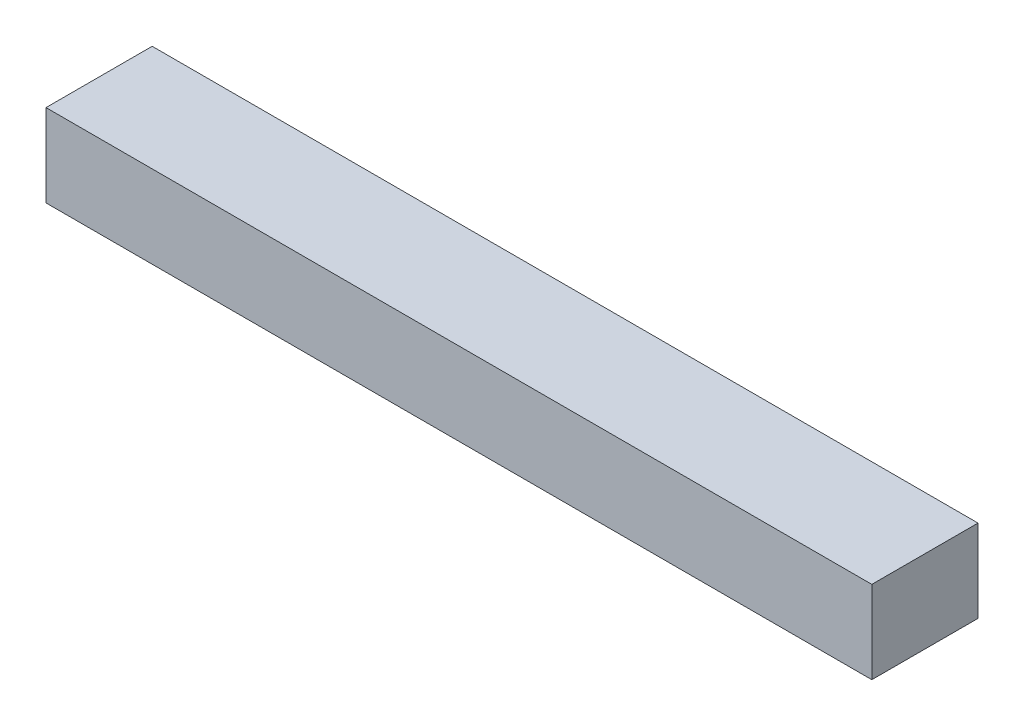
from build123d import *

# Parameters (mm, degrees)
SKETCH1_W           = 70
SKETCH1_H           = 9
BOSS_EXTRUDE1_DEPTH = 7


with BuildPart() as part:
    # Sketch1 → Boss-Extrude1 (new body)
    with BuildSketch(Plane(origin=(0, 0, 0), x_dir=(1, 0, 0), z_dir=(0, 1, 0))):
        with Locations((35, 4.5)):
            Rectangle(SKETCH1_W, SKETCH1_H)
    extrude(amount=BOSS_EXTRUDE1_DEPTH)


solid = part.part
